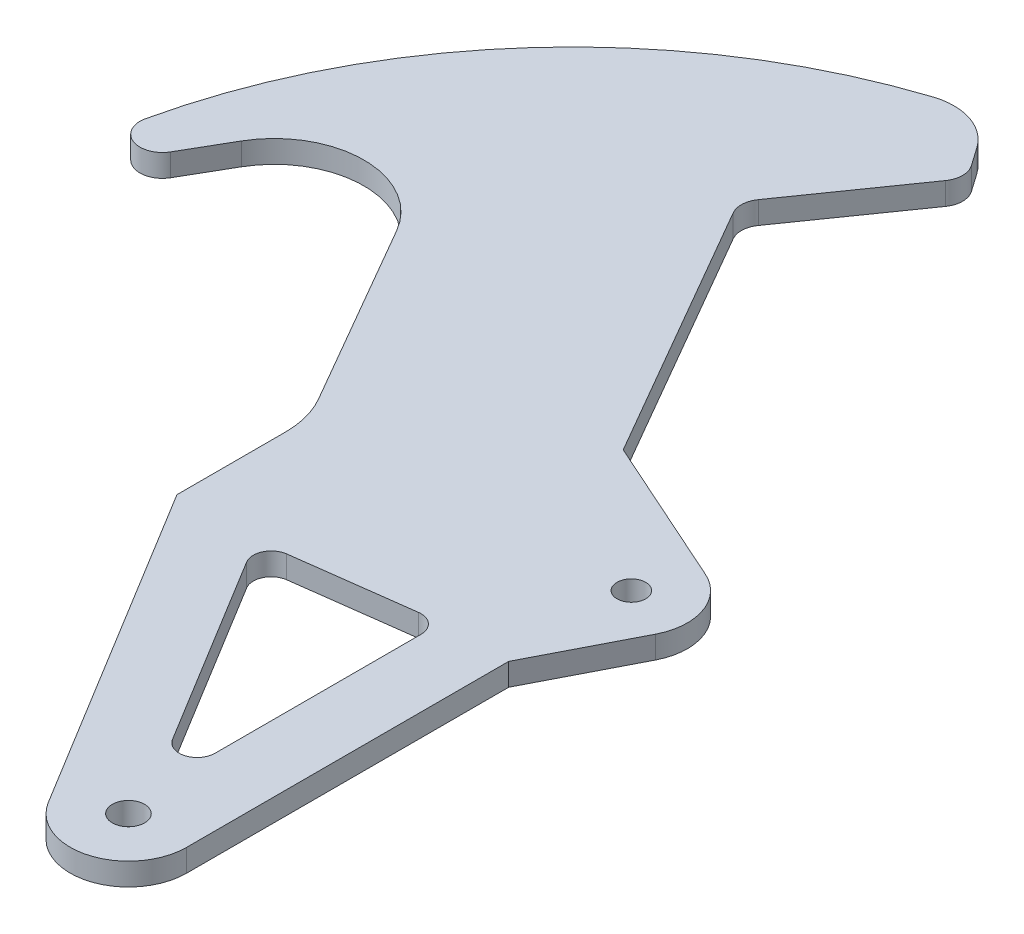
from build123d import *

# Parameters (mm, degrees)
SKETCH1_R           = 2.286
SKETCH1_R_2         = 2.032
BOSS_EXTRUDE1_DEPTH = 3.175
CUT_EXTRUDE2_DEPTH  = 112.968585757
FILLET2_R           = 2.54


with BuildPart() as part:
    # Sketch1 → Boss-Extrude1 (new body)
    with BuildSketch(Plane(origin=(0, 0, 0), x_dir=(1, 0, 0), z_dir=(0, 1, 0))):
        with BuildLine():
            Line((-10.998522628, 23.8125), (-14.664696837, 17.4625))
            ThreePointArc((-14.664696837, 17.4625), (-18.565068266, 16.090875015), (-20.514067317, 19.737195774))
            ThreePointArc((-20.514067317, 19.737195774), (-1.724819928, 56.016331719), (32.594151192, 78.184320885))
            ThreePointArc((32.594151192, 78.184320885), (37.76306443, 78.160416217), (41.904450725, 75.06733441))
            Line((41.904450725, 75.06733441), (43.72555591, 72.466526669))
            ThreePointArc((43.72555591, 72.466526669), (44.299748169, 70.645421484), (43.72555591, 68.824316299))
            Line((43.72555591, 68.824316299), (32.798924798, 53.219469855))
            ThreePointArc((32.798924798, 53.219469855), (32.227754435, 51.536856224), (32.650101881, 49.81086467))
            Line((32.650101881, 49.81086467), (53.922601881, 12.965813866))
            Line((53.922601881, 12.965813866), (74.99824615, 3.5308098))
            ThreePointArc((74.99824615, 3.5308098), (79.244408325, -1.084665848), (78.815031546, -7.341513637))
            Line((78.815031546, -7.341513637), (71.755, -21.081542183))
            Line((71.755, -21.081542183), (71.755, -66.675))
            ThreePointArc((71.755, -66.675), (65.736035896, -74.621393426), (56.456352278, -70.979886963))
            Line((56.456352278, -70.979886963), (27.822968614, -24.13))
            Line((27.822968614, -24.13), (27.822968614, -8.73125))
            ThreePointArc((27.822968614, -8.73125), (27.390226607, -5.444248127), (26.121491242, -2.38125))
            Line((26.121491242, -2.38125), (10.998522628, 23.8125))
            ThreePointArc((10.998522628, 23.8125), (0, 30.1625), (-10.998522628, 23.8125))
        make_face()
        with Locations(Location((63.5, -66.675, 0), (0, 0, 270))):
            Circle(SKETCH1_R, mode=Mode.SUBTRACT)
        with Locations(Location((71.755, -3.713861391, 0), (0, 0, 270))):
            Circle(SKETCH1_R_2, mode=Mode.SUBTRACT)
    extrude(amount=BOSS_EXTRUDE1_DEPTH)

    # Sketch4 → Cut-Extrude2 (cut, through all)
    with BuildSketch(Plane(origin=(0, 3.175, 0), x_dir=(1, 0, 0), z_dir=(0, 1, 0))):
        Polygon((38.986058834, -24.13), (62.23, -21.081542183), (62.23, -62.161691573), align=None)
    extrude(amount=-CUT_EXTRUDE2_DEPTH, mode=Mode.SUBTRACT)

    # Fillet2
    fillet2_edges = [part.edges().sort_by_distance(p)[0] for p in [
        (62.23, 1.5875, 62.161691573),
        (38.986058834, 1.5875, 24.13),
        (62.23, 1.5875, 21.081542183),
    ]]
    fillet(fillet2_edges, radius=FILLET2_R)


solid = part.part
